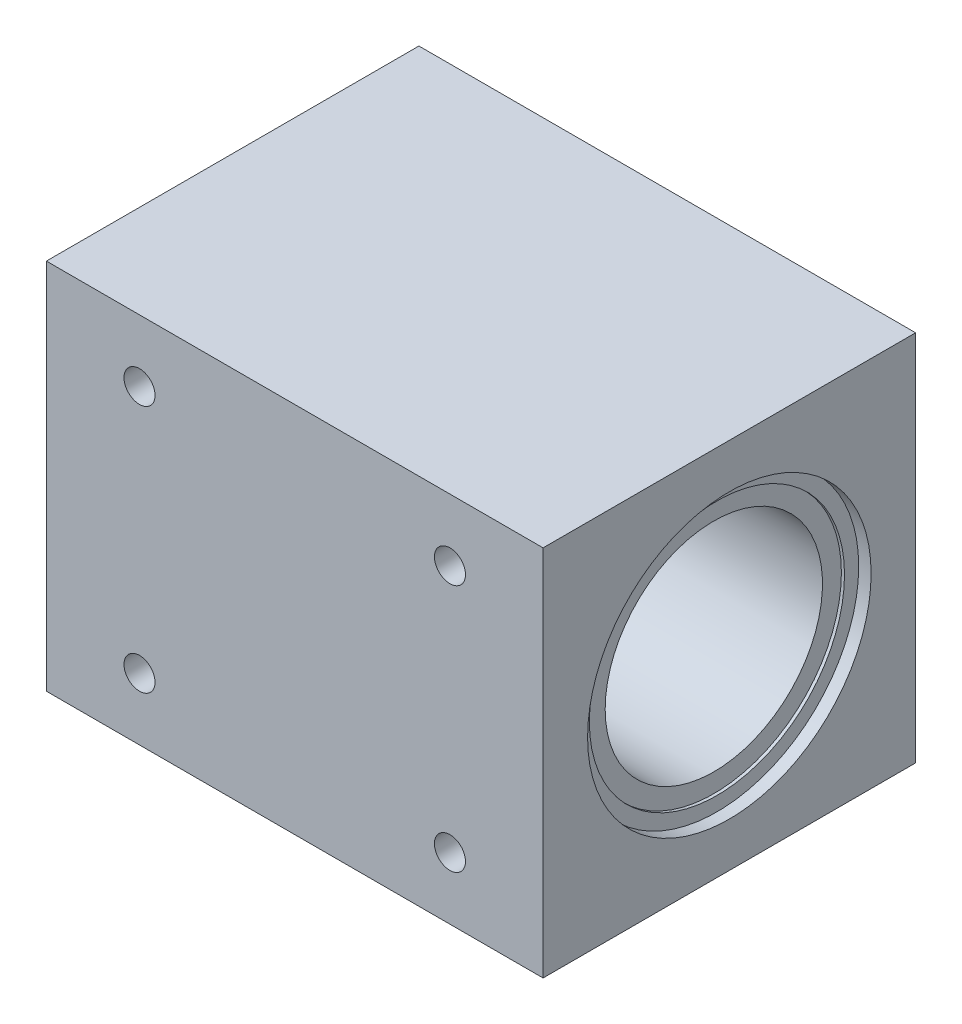
from build123d import *

# Parameters (mm, degrees)
SKETCH_1_W             = 60
SKETCH_1_H             = 60
SKETCH_1_R             = 17.5
EXTRUDE_1_DEPTH        = 80
HOLE_WIZARD_M6_1_D     = 5
HOLE_WIZARD_M6_1_DEPTH = 17
HOLE_WIZARD_M6_1_TIP   = 1.502151548


with BuildPart() as part:
    # 草图1 → 凸台-拉伸1 (new body)
    with BuildSketch(Plane(origin=(0, 0, 0), x_dir=(0, 0, -1), z_dir=(1, 0, 0))):
        Rectangle(SKETCH_1_W, SKETCH_1_H)
        Circle(SKETCH_1_R, mode=Mode.SUBTRACT)
    extrude(amount=EXTRUDE_1_DEPTH)

    # 草图6 → 切除-旋转5 (revolve, cut)
    with BuildSketch(Plane.XY):
        Polygon((0, 17.5), (2.5, 17.5), (2.5, 20.547619048), (2, 20.547619048), (2, 22.833333333), (0, 22.833333333), align=None)
    revolve(axis=Axis((80, 0, 0), (-1, 0, 0)), mode=Mode.SUBTRACT)

    # 草图7 → 切除-旋转6 (revolve, cut)
    with BuildSketch(Plane.XY):
        Polygon((77.5, 17.5), (80, 17.5), (80, 22.833333333), (78, 22.833333333), (78, 20.547619048), (77.5, 20.547619048), align=None)
    revolve(axis=Axis((80, 0, 0), (-1, 0, 0)), mode=Mode.SUBTRACT)

    # M6 螺纹孔1
    with Locations(Plane.XY.offset(30)):
        with Locations((15, 20), (15, -20), (65, -20), (65, 20)):
            Hole(HOLE_WIZARD_M6_1_D / 2, depth=HOLE_WIZARD_M6_1_DEPTH)
            with Locations((0, 0, -(HOLE_WIZARD_M6_1_DEPTH + HOLE_WIZARD_M6_1_TIP / 2))):  # 118° drill point
                Cone(0, HOLE_WIZARD_M6_1_D / 2, HOLE_WIZARD_M6_1_TIP, mode=Mode.SUBTRACT)


solid = part.part
